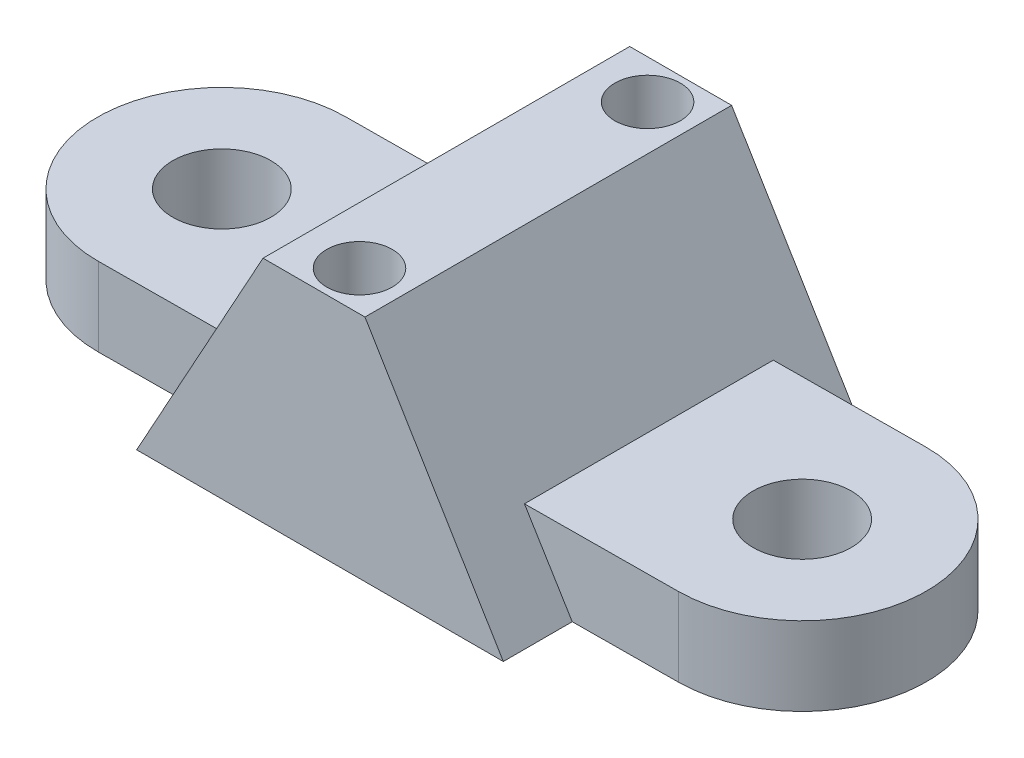
from build123d import *

# Parameters (mm, degrees)
EXTRUDE_1_DEPTH     = 56
SKETCH_3_R          = 7.5
EXTRUDE_3_DEPTH     = 12
SKETCH_4_R          = 5
CUT_EXTRUDE_1_DEPTH = 92.268833673


with BuildPart() as part:
    # 스케치1 → 보스-돌출1 (new body)
    with BuildSketch(Plane.XY):
        Polygon((-28, 0), (28, 0), (6.865874615, 35), (-8.698826384, 35), align=None)
    extrude(amount=EXTRUDE_1_DEPTH)

    # 스케치3 → 보스-돌출3 (add)
    with BuildSketch(Plane.XZ):
        with BuildLine():
            Line((-43.863739751, 45.99090258), (44.136260249, 45.35978625))
            ThreePointArc((44.136260249, 45.35978625), (62.999511392, 26.224014609), (43.863739751, 7.360763465))
            Line((43.863739751, 7.360763465), (-44.136260249, 7.991879796))
            ThreePointArc((-44.136260249, 7.991879796), (-62.999511392, 27.127651437), (-43.863739751, 45.99090258))
        make_face()
        with Locations(Location((-44, 26.991391188, 0), (0, 0, 270))):
            Circle(SKETCH_3_R, mode=Mode.SUBTRACT)
        with Locations(Location((44, 26.360274858, 0), (0, 0, 270))):
            Circle(SKETCH_3_R, mode=Mode.SUBTRACT)
    extrude(amount=-EXTRUDE_3_DEPTH)

    # 스케치4 → 컷-돌출1 (cut, through all)
    with BuildSketch(Plane(origin=(0, 35, 0), x_dir=(1, 0, 0), z_dir=(0, 1, 0))):
        with Locations(Location((0, -5.967731641, 0), (0, 0, 270))):
            Circle(SKETCH_4_R)
        with Locations(Location((0, -49.967731641, 0), (0, 0, 270))):
            Circle(SKETCH_4_R)
    extrude(amount=-CUT_EXTRUDE_1_DEPTH, mode=Mode.SUBTRACT)


solid = part.part
